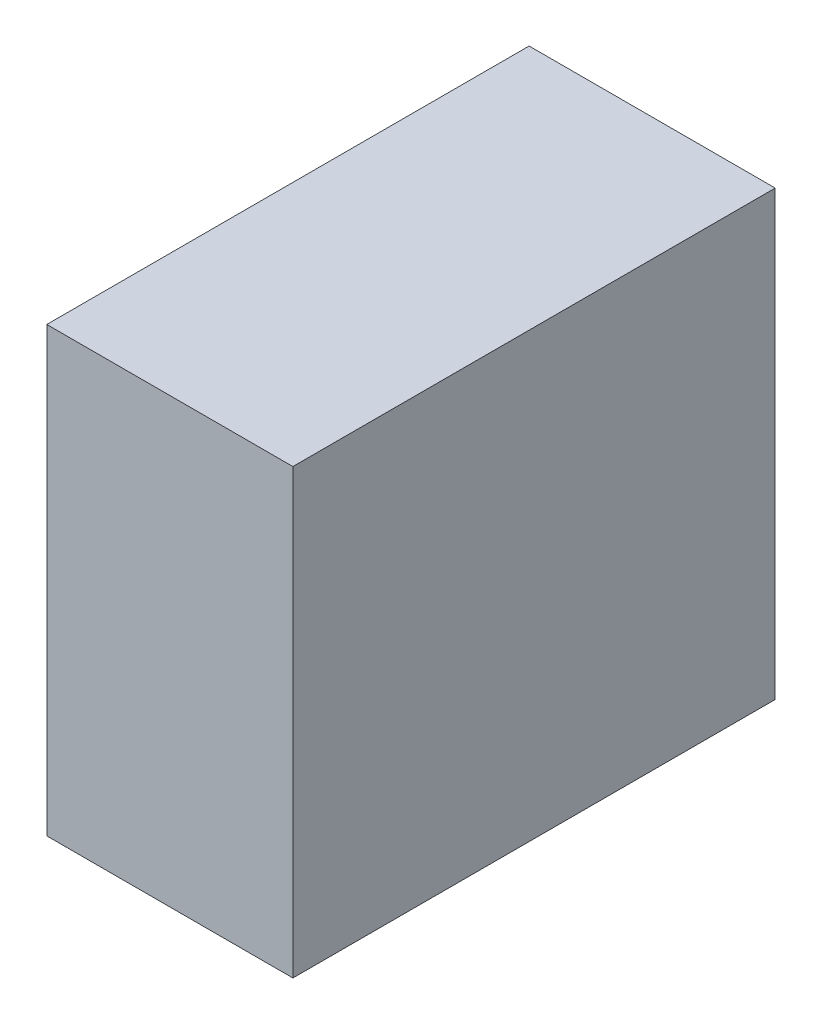
from build123d import *

# Parameters (mm, degrees)
ESBO_O1_W                = 50
ESBO_O1_H                = 90
RESSALTO_EXTRUS_O1_DEPTH = 98


with BuildPart() as part:
    # Esboço1 → Ressalto-extrusão1 (new body)
    with BuildSketch(Plane.XY):
        with Locations((25, 45)):
            Rectangle(ESBO_O1_W, ESBO_O1_H)
    extrude(amount=RESSALTO_EXTRUS_O1_DEPTH)


solid = part.part
